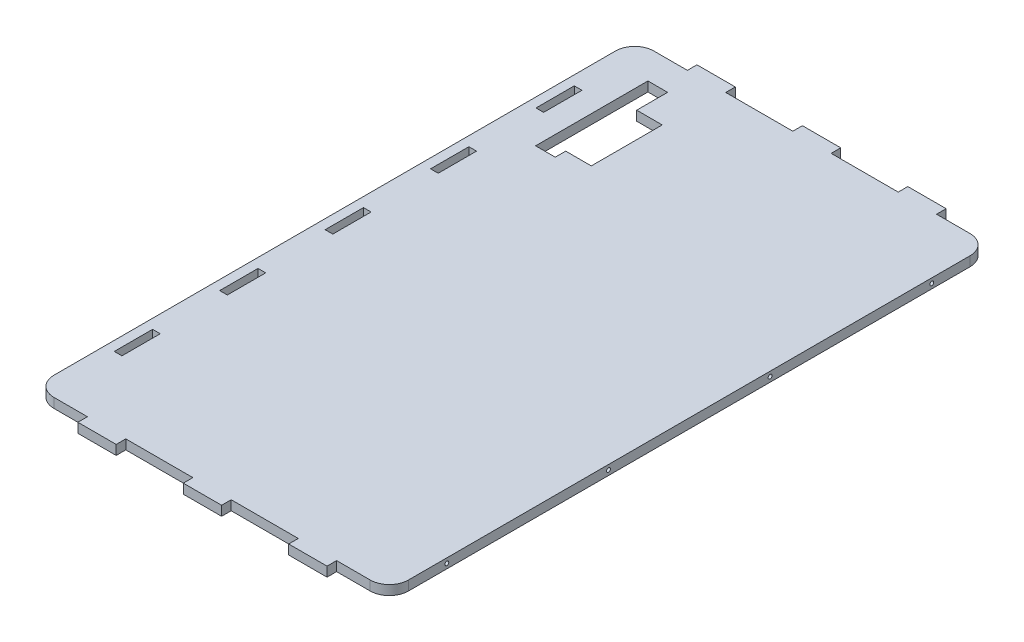
from build123d import *

# Parameters (mm, degrees)
SKETCH1_W               = 185
SKETCH1_H               = 313
BASE_DEPTH              = 5
SKETCH2_W               = 20
SKETCH2_H               = 5
BOSS_EXTRUDE2_DEPTH     = 5
LPATTERN1_COUNT         = 2
LPATTERN1_PITCH         = 55
LPATTERN1_COL_COUNT     = 2
LPATTERN1_COL_PITCH     = 55
SKETCH3_W               = 4
SKETCH3_H               = 20
CUT_EXTRUDE1_DEPTH      = 187.181363192
LPATTERN2_COUNT         = 3
LPATTERN2_PITCH         = 55
LPATTERN2_COL_COUNT     = 3
LPATTERN2_COL_PITCH     = 55
FILLET1_R               = 10
MIRROR1_COPY_1_SKETCH_W = 20
MIRROR1_COPY_1_SKETCH_H = 5
MIRROR1_COPY_1_DEPTH    = 5
MIRROR1_COPY_2_SKETCH_W = 20
MIRROR1_COPY_2_SKETCH_H = 5
MIRROR1_COPY_2_DEPTH    = 5
CUT_EXTRUDE4_DEPTH      = 187.181363192
LPATTERN5_COUNT         = 4
LPATTERN5_PITCH         = 84.333333333
CUT_EXTRUDE5_DEPTH      = 187.181363192


with BuildPart() as part:
    # Sketch1 → Base (new body)
    with BuildSketch(Plane(origin=(0, 0, 0), x_dir=(1, 0, 0), z_dir=(0, 1, 0))):
        Rectangle(SKETCH1_W, SKETCH1_H)
    extrude(amount=BASE_DEPTH)

    # Sketch2 → Boss-Extrude2 (add)
    with BuildSketch(Plane(origin=(0, 5, 0), x_dir=(1, 0, 0), z_dir=(0, 1, 0))):
        with Locations((0, -159)):
            Rectangle(SKETCH2_W, SKETCH2_H)
    boss_extrude2 = extrude(amount=-BOSS_EXTRUDE2_DEPTH)

    # LPattern1: Boss-Extrude2 ×2
    with Locations(*[(-i * LPATTERN1_PITCH, 0, 0) for i in range(1, LPATTERN1_COUNT)]):
        add(boss_extrude2)

    # LPattern1 col: Boss-Extrude2 ×2
    with Locations(*[(i * LPATTERN1_COL_PITCH, 0, 0) for i in range(1, LPATTERN1_COL_COUNT)]):
        add(boss_extrude2)

    # Sketch3 → Cut-Extrude1 (cut, through all)
    with BuildSketch(Plane(origin=(0, 5, 0), x_dir=(1, 0, 0), z_dir=(0, 1, 0))):
        with Locations((-85.5, 0)):
            Rectangle(SKETCH3_W, SKETCH3_H)
    cut_extrude1 = extrude(amount=-CUT_EXTRUDE1_DEPTH, mode=Mode.SUBTRACT)

    # LPattern2: Cut-Extrude1 ×3
    with Locations(*[(0, 0, -i * LPATTERN2_PITCH) for i in range(1, LPATTERN2_COUNT)]):
        add(cut_extrude1, mode=Mode.SUBTRACT)

    # LPattern2 col: Cut-Extrude1 ×3
    with Locations(*[(0, 0, i * LPATTERN2_COL_PITCH) for i in range(1, LPATTERN2_COL_COUNT)]):
        add(cut_extrude1, mode=Mode.SUBTRACT)

    # Fillet1
    fillet1_edges = [part.edges().sort_by_distance(p)[0] for p in [
        (-92.5, 2.5, -156.5),
        (92.5, 2.5, -156.5),
        (92.5, 2.5, 156.5),
        (-92.5, 2.5, 156.5),
    ]]
    fillet(fillet1_edges, radius=FILLET1_R)

    # Mirror1: Boss-Extrude2 across plane
    add(boss_extrude2.mirror(Plane.XY))

    # Mirror1 copy 1 sketch → Mirror1 copy 1 (add)
    with BuildSketch(Plane(origin=(-55, 5, 0), x_dir=(1, 0, 0), z_dir=(0, 1, 0))):
        with Locations((0, 159)):
            Rectangle(MIRROR1_COPY_1_SKETCH_W, MIRROR1_COPY_1_SKETCH_H)
    extrude(amount=-MIRROR1_COPY_1_DEPTH)

    # Mirror1 copy 2 sketch → Mirror1 copy 2 (add)
    with BuildSketch(Plane(origin=(55, 5, 0), x_dir=(1, 0, 0), z_dir=(0, 1, 0))):
        with Locations((0, 159)):
            Rectangle(MIRROR1_COPY_2_SKETCH_W, MIRROR1_COPY_2_SKETCH_H)
    extrude(amount=-MIRROR1_COPY_2_DEPTH)

    # Sketch5 → Cut-Extrude4 (cut, through all)
    with BuildSketch(Plane(origin=(0, 5, 0), x_dir=(1, 0, 0), z_dir=(0, 1, 0))):
        Polygon((-63.667363032, 141.40999982), (-70.5, 141.40999982), (-70.5, 136.502092421), (-70.5, 82.79999982), (-60.23, 82.79999982), (-60.23, 88.26099982), (-49.211989258, 88.26099982), (-49.211989258, 101.65899982), (-62.23, 101.65899982), (-62.23, 105.27899982), (-46.895, 105.27899982), (-46.895, 125.28099982), (-60.23, 125.28099982), (-60.23, 133.244848009), (-60.23, 141.40999982), align=None)
    extrude(amount=-CUT_EXTRUDE4_DEPTH, mode=Mode.SUBTRACT)

    # Sketch8 → Tap Drill for M2.5x0.45 Tap1 (revolve, cut)
    with BuildSketch(Plane(origin=(92.5, 2.5, -126.5), x_dir=(0, 0, -1), z_dir=(0, 1, 0))):
        Polygon((0, 0), (0, 5.615882135), (1.025, 5), (1.025, 0), align=None)
    tap_drill_for_m2_5x0_45_tap1 = revolve(axis=Axis((98.85, 2.5, -126.5), (-1, 0, 0)), mode=Mode.SUBTRACT)

    # LPattern5: Tap Drill for M2.5x0.45 Tap1 ×4
    with Locations(*[(0, 0, i * LPATTERN5_PITCH) for i in range(1, LPATTERN5_COUNT)]):
        add(tap_drill_for_m2_5x0_45_tap1, mode=Mode.SUBTRACT)

    # Sketch9 → Cut-Extrude5 (cut, through all)
    with BuildSketch(Plane(origin=(0, 0, 0), x_dir=(-1, 0, 0), z_dir=(0, -1, 0))):
        Polygon((46.895, 105.27899982), (46.895, 88.26099982), (49.211989258, 88.26099982), (49.211989258, 101.65899982), (62.23, 101.65899982), (62.23, 105.27899982), (49.211989258, 105.27899982), align=None)
    extrude(amount=-CUT_EXTRUDE5_DEPTH, mode=Mode.SUBTRACT)


solid = part.part
